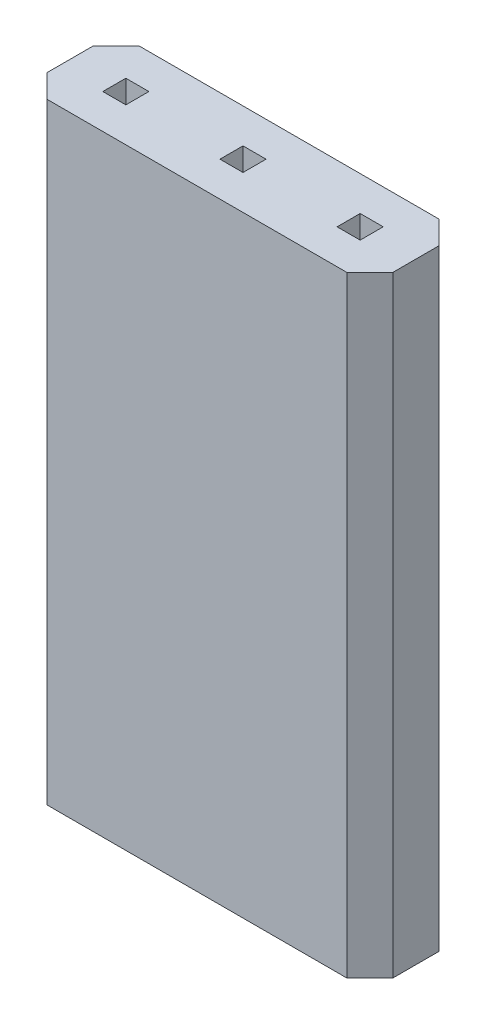
from build123d import *

# Parameters (mm, degrees)
SKETCH_1_W          = 7.5
SKETCH_1_H          = 2
EXTRUDE_1_DEPTH     = 13.25
CUT_EXTRUDE_START   = 13.25
SKETCH_2_W          = 0.5
SKETCH_2_H          = 0.5
CUT_EXTRUDE_1_DEPTH = 7
CUT_EXTRUDE_2_DEPTH = 14.806701271


with BuildPart() as part:
    # 草图1 → 凸台-拉伸1 (new body)
    with BuildSketch(Plane(origin=(0, 0, 0), x_dir=(1, 0, 0), z_dir=(0, 1, 0))):
        Rectangle(SKETCH_1_W, SKETCH_1_H)
    extrude(amount=EXTRUDE_1_DEPTH)

    # 草图2 → 切除-拉伸1 (cut)
    with BuildSketch(Plane(origin=(0, 0, 0), x_dir=(1, 0, 0), z_dir=(0, 1, 0)).offset(CUT_EXTRUDE_START)):
        with Locations((2.54, 0)):
            Rectangle(SKETCH_2_W, SKETCH_2_H)
        Rectangle(SKETCH_2_W, SKETCH_2_H)
        with Locations((-2.54, 0)):
            Rectangle(SKETCH_2_W, SKETCH_2_H)
    extrude(amount=-CUT_EXTRUDE_1_DEPTH, mode=Mode.SUBTRACT)

    # 草图3 → 切除-拉伸2 (cut, through all)
    with BuildSketch(Plane(origin=(0, 0, 0), x_dir=(1, 0, 0), z_dir=(0, 1, 0))):
        Polygon((-3.25, -1), (-3.75, -0.5), (-3.75, -1), align=None)
        Polygon((-3.75, 0.5), (-3.25, 1), (-3.75, 1), align=None)
        Polygon((3.75, -0.5), (3.25, -1), (3.75, -1), align=None)
        Polygon((3.25, 1), (3.75, 1), (3.75, 0.5), align=None)
    extrude(amount=CUT_EXTRUDE_2_DEPTH, mode=Mode.SUBTRACT)


solid = part.part
